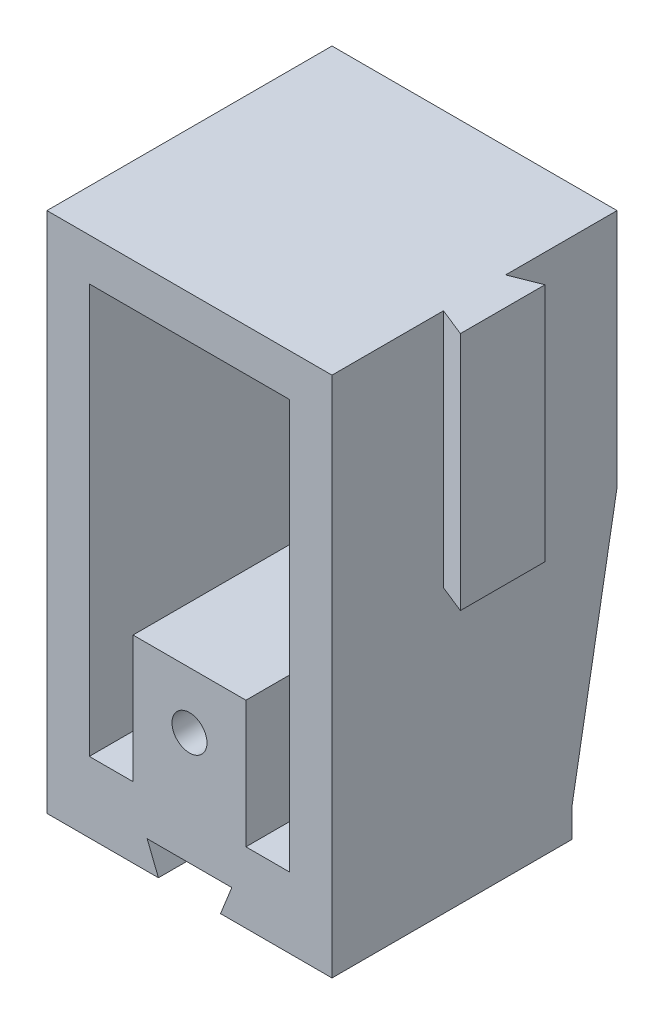
from build123d import *

# Parameters (mm, degrees)
BOSS_EXTRUDE1_DEPTH = 42.5
BOSS_EXTRUDE2_DEPTH = 50
CUT_EXTRUDE1_DEPTH  = 70
CUT_EXTRUDE2_DEPTH  = 70
SKETCH4_R           = 3.1
CUT_EXTRUDE3_DEPTH  = 70
CUT_EXTRUDE4_DEPTH  = 55


with BuildPart() as part:
    # Sketch1 → Boss-Extrude1 (new body)
    with BuildSketch(Plane(origin=(0, 0, 0), x_dir=(1, 0, 0), z_dir=(0, 1, 0))):
        Polygon((25.25, -25.25), (25.25, -5.5), (30.25, -7.5), (30.25, 7.5), (25.25, 5.5), (25.25, 25.25), (-25.25, 25.25), (-25.25, -25.25), align=None)
    extrude(amount=BOSS_EXTRUDE1_DEPTH)

    # Sketch1<3> → Boss-Extrude2 (add)
    with BuildSketch(Plane(origin=(0, 0, 0), x_dir=(1, 0, 0), z_dir=(0, 1, 0))):
        Polygon((25.25, -5.5), (25.25, 5.5), (25.25, 25.25), (-25.25, 25.25), (-25.25, -25.25), (25.25, -25.25), align=None)
    extrude(amount=-BOSS_EXTRUDE2_DEPTH)

    # Sketch2 → Cut-Extrude1 (cut)
    with BuildSketch(Plane(origin=(0, 0, -25.25), x_dir=(-1, 0, 0), z_dir=(0, 0, -1))):
        Polygon((-5.5, -50), (-7.5, -45), (7.5, -45), (5.5, -50), align=None)
    extrude(amount=-CUT_EXTRUDE1_DEPTH, mode=Mode.SUBTRACT)

    # Sketch3 → Cut-Extrude2 (cut)
    with BuildSketch(Plane(origin=(25.25, 0, 0), x_dir=(0, 0, -1), z_dir=(1, 0, 0))):
        Polygon((17.25, -50), (25.25, -50), (25.25, 0), (17.25, -45), align=None)
    extrude(amount=-CUT_EXTRUDE2_DEPTH, mode=Mode.SUBTRACT)

    # Sketch4 → Cut-Extrude3 (cut)
    with BuildSketch(Plane.XY.offset(25.25)):
        with Locations((0, -25)):
            Circle(SKETCH4_R)
    extrude(amount=-CUT_EXTRUDE3_DEPTH, mode=Mode.SUBTRACT)

    # Sketch5 → Cut-Extrude4 (cut)
    with BuildSketch(Plane.XY.offset(25.25)):
        Polygon((17.75, 35), (-17.75, 35), (-17.75, -37.5), (-10, -37.5), (-10, -15), (10, -15), (10, -37.5), (17.75, -37.5), align=None)
    extrude(amount=-CUT_EXTRUDE4_DEPTH, mode=Mode.SUBTRACT)


solid = part.part
